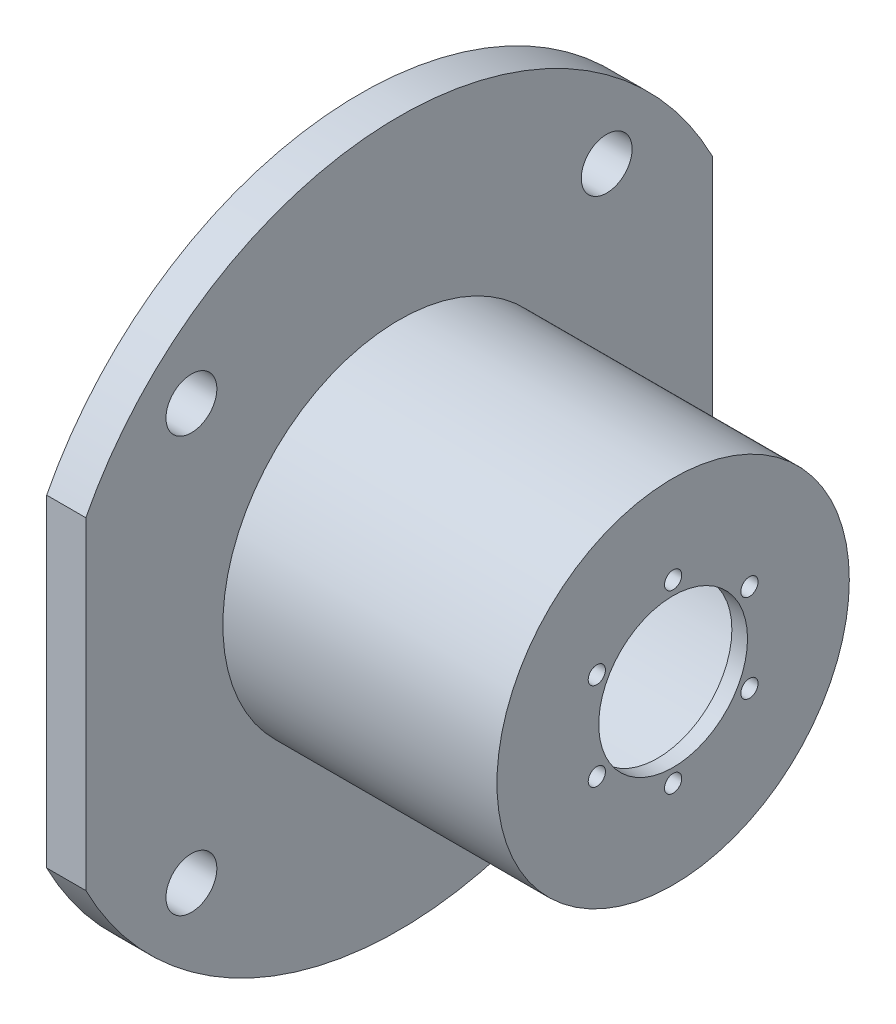
from build123d import *

# Parameters (mm, degrees)
SZKIC2_R                   = 3.25
SZKIC2_R_2                 = 1.1
SZKIC2_W                   = 5
SZKIC2_H                   = 41.231056256
WYTNIJ_WYCI_GNI_CIE1_DEPTH = 76.166481892


with BuildPart() as part:
    # Szkic1 → Obrót1 (revolve)
    with BuildSketch(Plane.XY, mode=Mode.PRIVATE) as obr_t1_sk:
        Polygon((-2, 9.5), (-2, 20), (-40, 20), (-40, 45), (-35, 45), (-35, 22.5), (0, 22.5), (0, 9.5), align=None)
    revolve(obr_t1_sk.sketch.rotate(Axis((0, 0, 0), (-1, 0, 0)), 90), axis=Axis((0, 0, 0), (-1, 0, 0)))

    # Szkic2 → Wytnij-wyciągnięcie1 (cut, through all)
    with BuildSketch(Plane(origin=(0, 0, 0), x_dir=(0, 0, -1), z_dir=(1, 0, 0))):
        with Locations((26.516504294, 26.516504294)):
            Circle(SZKIC2_R)
        with Locations((26.516504294, -26.516504294)):
            Circle(SZKIC2_R)
        with Locations((-26.516504294, -26.516504294)):
            Circle(SZKIC2_R)
        with Locations((-26.516504294, 26.516504294)):
            Circle(SZKIC2_R)
        with Locations((0, 11.25)):
            Circle(SZKIC2_R_2)
        with Locations((9.742785793, 5.625)):
            Circle(SZKIC2_R_2)
        with Locations((9.742785793, -5.625)):
            Circle(SZKIC2_R_2)
        with Locations((0, -11.25)):
            Circle(SZKIC2_R_2)
        with Locations((-9.742785793, -5.625)):
            Circle(SZKIC2_R_2)
        with Locations((-9.742785793, 5.625)):
            Circle(SZKIC2_R_2)
        with Locations((-42.5, 0)):
            Rectangle(SZKIC2_W, SZKIC2_H)
        with Locations((42.5, 0)):
            Rectangle(SZKIC2_W, SZKIC2_H)
    extrude(amount=-WYTNIJ_WYCI_GNI_CIE1_DEPTH, mode=Mode.SUBTRACT)


solid = part.part
